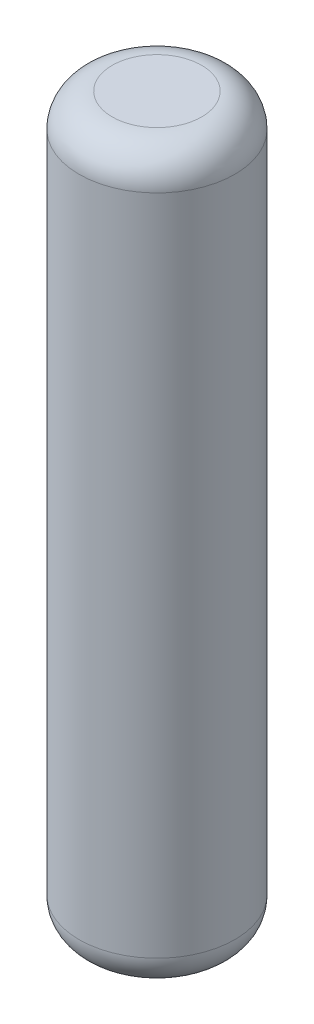
from build123d import *

# Parameters (mm, degrees)
SKETCH_1_R      = 2.35
EXTRUDE_1_DEPTH = 22
FILLET_1_R      = 1


with BuildPart() as part:
    # 草图1 → 凸台-拉伸1 (new body)
    with BuildSketch(Plane(origin=(0, 0, 0), x_dir=(1, 0, 0), z_dir=(0, 1, 0))):
        with Locations(Location((0, 0, 0), (0, 0, 270))):
            Circle(SKETCH_1_R)
    extrude(amount=EXTRUDE_1_DEPTH)

    # 圆角1
    fillet_1_edges = [part.edges().sort_by_distance(p)[0] for p in [
        (0, 0, -2.35),
        (0, 22, -2.35),
    ]]
    fillet(fillet_1_edges, radius=FILLET_1_R)


solid = part.part
